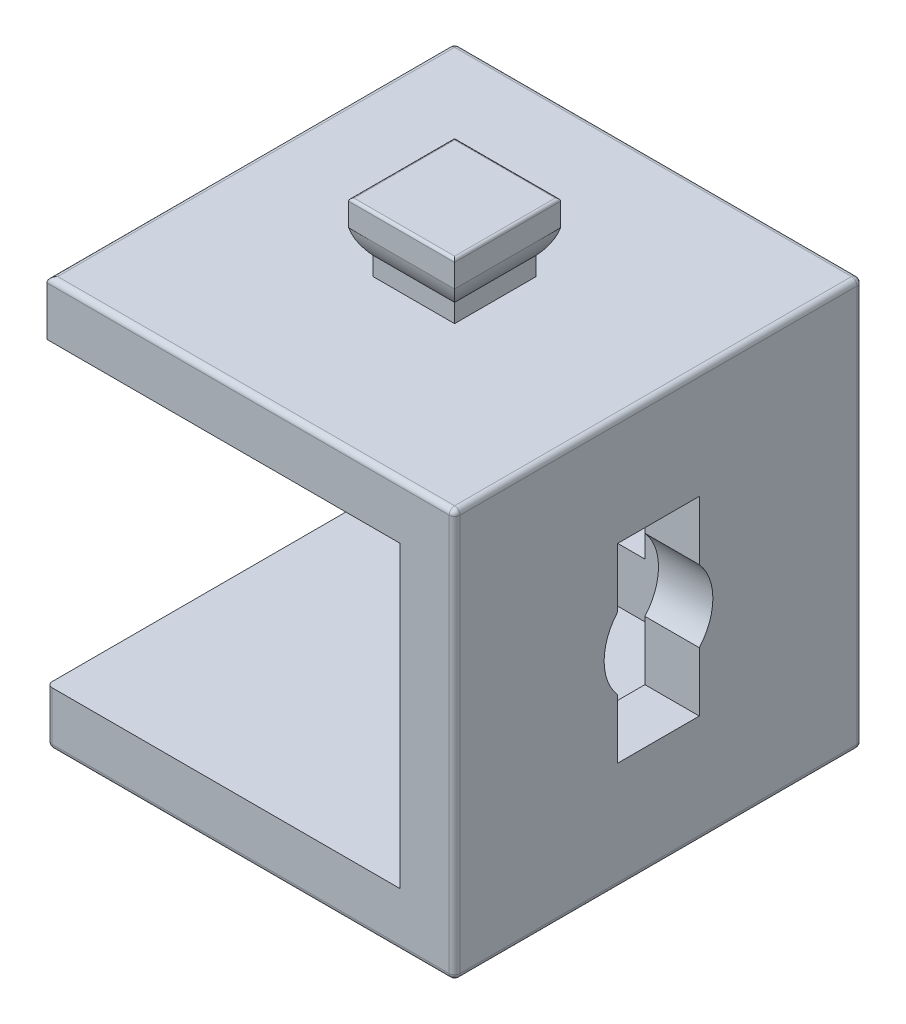
from build123d import *

# Parameters (mm, degrees)
SKETCH_1_W                      = 15
SKETCH_1_H                      = 15
EXTRUDE_1_DEPTH                 = 15
SKETCH_2_W                      = 13
SKETCH_2_H                      = 11
CUT_EXTRUDE_1_DEPTH             = 13
EXTRUDE_START                   = -4.5
EXTRUDE_2_DEPTH                 = 6
SKETCH_5_W                      = 3
SKETCH_5_H                      = 3
EXTRUDE_3_DEPTH                 = 1
CUT_EXTRUDE_3_REACH             = 26.238
CUT_EXTRUDE_4_REACH             = 29.5
CUT_EXTRUDE_5_REACH             = 26.238
CUT_EXTRUDE_5_DIRECTION_2_REACH = 26.238
FILLET_1_R                      = 0.1
FILLET_2_R                      = 0.2
EXTRUDE_4_DEPTH                 = 3
EXTRUDE_4_DEPTH_BACK            = 3
CUT_EXTRUDE_6_DEPTH             = 15
FILLET_3_R                      = 0.1


with BuildPart() as part:
    # 草图1 → 凸台-拉伸1 (new body)
    with BuildSketch(Plane.XY):
        with Locations((0, 7.5)):
            Rectangle(SKETCH_1_W, SKETCH_1_H)
    extrude(amount=-EXTRUDE_1_DEPTH)

    # 草图2 → 切除-拉伸1 (cut)
    with BuildSketch(Plane.ZY.offset(7.5)):
        with Locations((-6.5, 7.5)):
            Rectangle(SKETCH_2_W, SKETCH_2_H)
    extrude(amount=-CUT_EXTRUDE_1_DEPTH, mode=Mode.SUBTRACT)



with BuildPart() as body_2:
    # 草图4 → 凸台-拉伸2 (new body)
    with BuildSketch(Plane.XY.offset(EXTRUDE_START)):
        with BuildLine():
            Line((-1.5, 15.677124344), (1.5, 15.677124344))
            ThreePointArc((1.5, 15.677124344), (1.780042303, 16.088161527), (1.95, 16.555590279))
            Line((1.95, 16.555590279), (1.95, 17.5))
            Line((1.95, 17.5), (-1.95, 17.5))
            Line((-1.95, 17.5), (-1.95, 16.555590279))
            ThreePointArc((-1.95, 16.555590279), (-1.780042303, 16.088161527), (-1.5, 15.677124344))
        make_face()
    extrude(amount=-EXTRUDE_2_DEPTH)


with BuildPart() as part_1:
    add(part.part)

    add(body_2.part)  # 凸台-拉伸3 merges body 2
    # 草图5 → 凸台-拉伸3 (add)
    with BuildSketch(Plane(origin=(0, 15, 0), x_dir=(-1, 0, 0), z_dir=(0, 1, 0))):
        with Locations((0, -7.5)):
            Rectangle(SKETCH_5_W, SKETCH_5_H)
    extrude(amount=EXTRUDE_3_DEPTH)

    # 草图6 → 切除-拉伸3 (cut, up to next)
    with BuildSketch(Plane(origin=(0, 0, -15), x_dir=(-1, 0, 0), z_dir=(0, 0, -1)), mode=Mode.PRIVATE) as cut_extrude_3_sk1:
        with BuildLine():
            Line((-1.5, 6.177124344), (-1.5, 4))
            Line((-1.5, 4), (1.5, 4))
            Line((1.5, 4), (1.5, 6.177124344))
            ThreePointArc((1.5, 6.177124344), (2, 7.5), (1.5, 8.822875656))
            Line((1.5, 8.822875656), (1.5, 11))
            Line((1.5, 11), (-1.5, 11))
            Line((-1.5, 11), (-1.5, 8.822875656))
            ThreePointArc((-1.5, 8.822875656), (-2, 7.5), (-1.5, 6.177124344))
        make_face()
    cut_extrude_3_tool1 = extrude(cut_extrude_3_sk1.sketch, amount=-CUT_EXTRUDE_3_REACH, mode=Mode.PRIVATE) & part_1.part
    add(cut_extrude_3_tool1.solids().sort_by_distance((0, 7.5, -15))[0], mode=Mode.SUBTRACT)

    # 草图7 → 切除-拉伸4 (cut, up to next)
    with BuildSketch(Plane(origin=(7.5, 0, 0), x_dir=(0, 0, -1), z_dir=(1, 0, 0)), mode=Mode.PRIVATE) as cut_extrude_4_sk1:
        with BuildLine():
            Line((6, 6.177124344), (6, 4))
            Line((6, 4), (9, 4))
            Line((9, 4), (9, 6.177124344))
            ThreePointArc((9, 6.177124344), (9.5, 7.5), (9, 8.822875656))
            Line((9, 8.822875656), (9, 11))
            Line((9, 11), (6, 11))
            Line((6, 11), (6, 8.822875656))
            ThreePointArc((6, 8.822875656), (5.5, 7.5), (6, 6.177124344))
        make_face()
    cut_extrude_4_tool1 = extrude(cut_extrude_4_sk1.sketch, amount=-CUT_EXTRUDE_4_REACH, mode=Mode.PRIVATE) & part_1.part
    add(cut_extrude_4_tool1.solids().sort_by_distance((7.5, 7.5, -7.5))[0], mode=Mode.SUBTRACT)

    # 草图8 → 切除-拉伸5 (cut, up to next)
    with BuildSketch(Plane(origin=(0, 0, 0), x_dir=(0, 0, -1), z_dir=(1, 0, 0)), mode=Mode.PRIVATE) as cut_extrude_5_sk1:
        with BuildLine():
            Line((5.55, 17.5), (5.55, 16.555590279))
            ThreePointArc((5.55, 16.555590279), (5.719957697, 16.088161527), (6, 15.677124344))
            Line((6, 15.677124344), (4.5, 15.677124344))
            Line((4.5, 15.677124344), (4.5, 17.5))
            Line((4.5, 17.5), (5.55, 17.5))
        make_face()
    cut_extrude_5_tool1 = extrude(cut_extrude_5_sk1.sketch, amount=-CUT_EXTRUDE_5_REACH, mode=Mode.PRIVATE) & part_1.part
    # 草图8 → 切除-拉伸5 (cut, up to next)
    with BuildSketch(Plane(origin=(0, 0, 0), x_dir=(0, 0, -1), z_dir=(1, 0, 0)), mode=Mode.PRIVATE) as cut_extrude_5_sk2:
        with BuildLine():
            Line((10.5, 17.5), (9.45, 17.5))
            Line((9.45, 17.5), (9.45, 16.555590279))
            ThreePointArc((9.45, 16.555590279), (9.280042303, 16.088161527), (9, 15.677124344))
            Line((9, 15.677124344), (10.5, 15.677124344))
            Line((10.5, 15.677124344), (10.5, 17.5))
        make_face()
    cut_extrude_5_tool2 = extrude(cut_extrude_5_sk2.sketch, amount=-CUT_EXTRUDE_5_REACH, mode=Mode.PRIVATE) & part_1.part
    add(cut_extrude_5_tool1.solids().sort_by_distance((0, 16.539049, -5.075076))[0], mode=Mode.SUBTRACT)
    add(cut_extrude_5_tool2.solids().sort_by_distance((0, 16.539049, -9.924924))[0], mode=Mode.SUBTRACT)

    # 草图8 → 切除-拉伸5 direction 2 (cut, up to next)
    with BuildSketch(Plane(origin=(0, 0, 0), x_dir=(0, 0, -1), z_dir=(1, 0, 0)), mode=Mode.PRIVATE) as cut_extrude_5_direction_2_sk1:
        with BuildLine():
            Line((5.55, 17.5), (5.55, 16.555590279))
            ThreePointArc((5.55, 16.555590279), (5.719957697, 16.088161527), (6, 15.677124344))
            Line((6, 15.677124344), (4.5, 15.677124344))
            Line((4.5, 15.677124344), (4.5, 17.5))
            Line((4.5, 17.5), (5.55, 17.5))
        make_face()
    cut_extrude_5_direction_2_tool1 = extrude(cut_extrude_5_direction_2_sk1.sketch, amount=CUT_EXTRUDE_5_DIRECTION_2_REACH, mode=Mode.PRIVATE) & part_1.part
    # 草图8 → 切除-拉伸5 direction 2 (cut, up to next)
    with BuildSketch(Plane(origin=(0, 0, 0), x_dir=(0, 0, -1), z_dir=(1, 0, 0)), mode=Mode.PRIVATE) as cut_extrude_5_direction_2_sk2:
        with BuildLine():
            Line((10.5, 17.5), (9.45, 17.5))
            Line((9.45, 17.5), (9.45, 16.555590279))
            ThreePointArc((9.45, 16.555590279), (9.280042303, 16.088161527), (9, 15.677124344))
            Line((9, 15.677124344), (10.5, 15.677124344))
            Line((10.5, 15.677124344), (10.5, 17.5))
        make_face()
    cut_extrude_5_direction_2_tool2 = extrude(cut_extrude_5_direction_2_sk2.sketch, amount=CUT_EXTRUDE_5_DIRECTION_2_REACH, mode=Mode.PRIVATE) & part_1.part
    add(cut_extrude_5_direction_2_tool1.solids().sort_by_distance((0, 16.539049, -5.075076))[0], mode=Mode.SUBTRACT)
    add(cut_extrude_5_direction_2_tool2.solids().sort_by_distance((0, 16.539049, -9.924924))[0], mode=Mode.SUBTRACT)

    # 圆角1
    fillet_1_edges = [part_1.edges().sort_by_distance(p)[0] for p in [
        (0, 17.5, -5.55),
        (1.95, 17.5, -7.5),
        (-1.95, 17.5, -7.5),
        (0, 17.5, -9.45),
    ]]
    fillet(fillet_1_edges, radius=FILLET_1_R)

    # 圆角2
    fillet_2_edges = [part_1.edges().sort_by_distance(p)[0] for p in [
        (0, 0, 0),
        (7.5, 0, -7.5),
        (0, 0, -15),
        (-7.5, 0, -7.5),
        (7.5, 7.5, -15),
        (0, 15, -15),
        (-7.5, 15, -7.5),
        (-7.5, 7.5, -15),
        (-7.5, 1, 0),
        (7.5, 7.5, 0),
        (7.5, 15, -7.5),
        (0, 15, 0),
    ]]
    fillet(fillet_2_edges, radius=FILLET_2_R)

    # 草图9 → 凸台-拉伸4 (add, two sides: drawn at the far end of the back side and taken through both)
    with BuildSketch(Plane(origin=(0, 0, 0), x_dir=(0, 0, -1), z_dir=(1, 0, 0)).offset(-EXTRUDE_4_DEPTH_BACK)):
        with BuildLine():
            Line((6, 0), (9, 0))
            Line((9, 0), (9, -0.677124344))
            ThreePointArc((9, -0.677124344), (9.280042303, -1.088161527), (9.45, -1.555590279))
            Line((9.45, -1.555590279), (9.45, -2.5))
            Line((9.45, -2.5), (5.55, -2.5))
            Line((5.55, -2.5), (5.55, -1.555590279))
            ThreePointArc((5.55, -1.555590279), (5.719957697, -1.088161527), (6, -0.677124344))
            Line((6, -0.677124344), (6, 0))
        make_face()
    extrude(amount=EXTRUDE_4_DEPTH + EXTRUDE_4_DEPTH_BACK)

    # 草图10 → 切除-拉伸6 (cut)
    with BuildSketch(Plane.XY):
        with BuildLine():
            Line((-1.95, -2.5), (-1.95, -1.555590279))
            ThreePointArc((-1.95, -1.555590279), (-1.780042303, -1.088161527), (-1.5, -0.677124344))
            Line((-1.5, -0.677124344), (-1.5, 0))
            Line((-1.5, 0), (-3, 0))
            Line((-3, 0), (-3, -2.5))
            Line((-3, -2.5), (-1.95, -2.5))
        make_face()
        with BuildLine():
            Line((1.5, 0), (1.5, -0.677124344))
            ThreePointArc((1.5, -0.677124344), (1.780042303, -1.088161527), (1.95, -1.555590279))
            Line((1.95, -1.555590279), (1.95, -2.5))
            Line((1.95, -2.5), (3, -2.5))
            Line((3, -2.5), (3, 0))
            Line((3, 0), (1.5, 0))
        make_face()
    extrude(amount=-CUT_EXTRUDE_6_DEPTH, mode=Mode.SUBTRACT)

    # 圆角3
    fillet_3_edges = [part_1.edges().sort_by_distance(p)[0] for p in [
        (0, -2.5, -9.45),
        (0, -2.5, -5.55),
        (-1.95, -2.5, -7.5),
        (1.95, -2.5, -7.5),
    ]]
    fillet(fillet_3_edges, radius=FILLET_3_R)


solid = part_1.part
